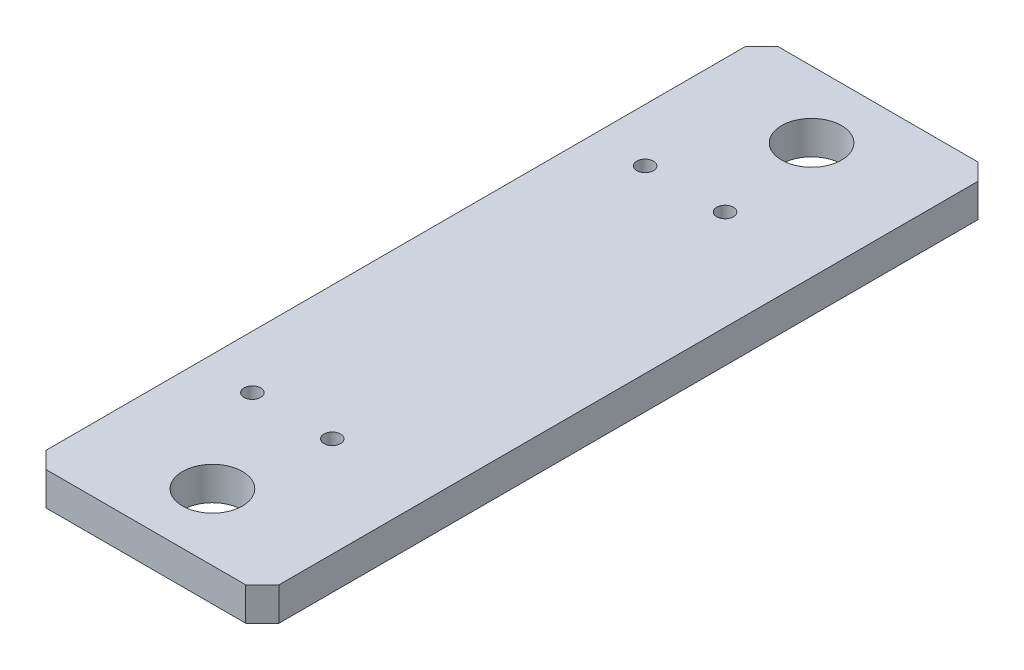
from build123d import *

# Parameters (mm, degrees)
SKETCH_1_W              = 70
SKETCH_1_H              = 220
EXTRUDE_1_DEPTH         = 10
HOLE_WIZARD_M6_1_D      = 5
HOLE_WIZARD_18_0_18_1_D = 18
CHAMFER_1_SIZE          = 5


with BuildPart() as part:
    # 草圖1 → 伸長1 (new body)
    with BuildSketch(Plane(origin=(0, 0, 0), x_dir=(1, 0, 0), z_dir=(0, 1, 0))):
        Rectangle(SKETCH_1_W, SKETCH_1_H)
    extrude(amount=EXTRUDE_1_DEPTH)

    # M6 螺紋孔1 (through all)
    with Locations(Plane(origin=(0, 10, 0), x_dir=(-1, 0, 0), z_dir=(0, 1, 0))):
        with Locations((19, -59), (19, 59), (-5, -59), (-5, 59)):
            Hole(HOLE_WIZARD_M6_1_D / 2)

    # Ø18.0 (18) 直徑孔1 (through all)
    with Locations(Plane(origin=(0, 10, 0), x_dir=(-1, 0, 0), z_dir=(0, 1, 0))):
        with Locations((0, -90), (0, 90)):
            Hole(HOLE_WIZARD_18_0_18_1_D / 2)

    # 導角1
    chamfer_1_edges = [part.edges().sort_by_distance(p)[0] for p in [
        (-35, 5, -110),
        (35, 5, -110),
        (35, 5, 110),
        (-35, 5, 110),
    ]]
    chamfer(chamfer_1_edges, length=CHAMFER_1_SIZE)


solid = part.part
